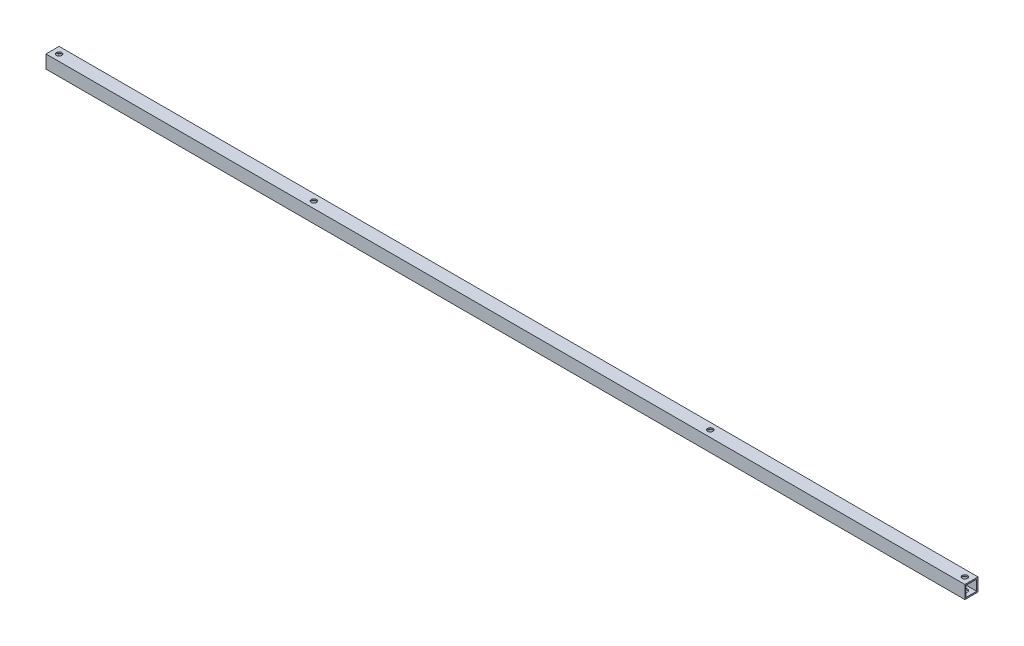
from build123d import *

# Parameters (mm, degrees)
SKETCH_1_W          = 10
SKETCH_1_H          = 10
SKETCH_1_W_2        = 8
SKETCH_1_H_2        = 8
EXTRUDE_1_DEPTH     = 700
SKETCH_2_R          = 2
CUT_EXTRUDE_1_DEPTH = 701.089280021


with BuildPart() as part:
    # ｽｹｯﾁ1 → 押し出し-薄板1 (new body)
    with BuildSketch(Plane(origin=(0, 0, 0), x_dir=(0, 0, -1), z_dir=(1, 0, 0))):
        Rectangle(SKETCH_1_W, SKETCH_1_H)
        Rectangle(SKETCH_1_W_2, SKETCH_1_H_2, mode=Mode.SUBTRACT)
    extrude(amount=EXTRUDE_1_DEPTH)

    # ｽｹｯﾁ2 → ｶｯﾄ - 押し出し1 (cut, through all)
    with BuildSketch(Plane(origin=(0, 5, 0), x_dir=(1, 0, 0), z_dir=(0, 1, 0))):
        with Locations(Location((695, 0, 0), (0, 0, 270))):
            Circle(SKETCH_2_R)
        with Locations(Location((5, 0, 0), (0, 0, 270))):
            Circle(SKETCH_2_R)
        with Locations(Location((501, 0, 0), (0, 0, 270))):
            Circle(SKETCH_2_R)
        with Locations(Location((199, 0, 0), (0, 0, 270))):
            Circle(SKETCH_2_R)
    extrude(amount=-CUT_EXTRUDE_1_DEPTH, mode=Mode.SUBTRACT)


solid = part.part
